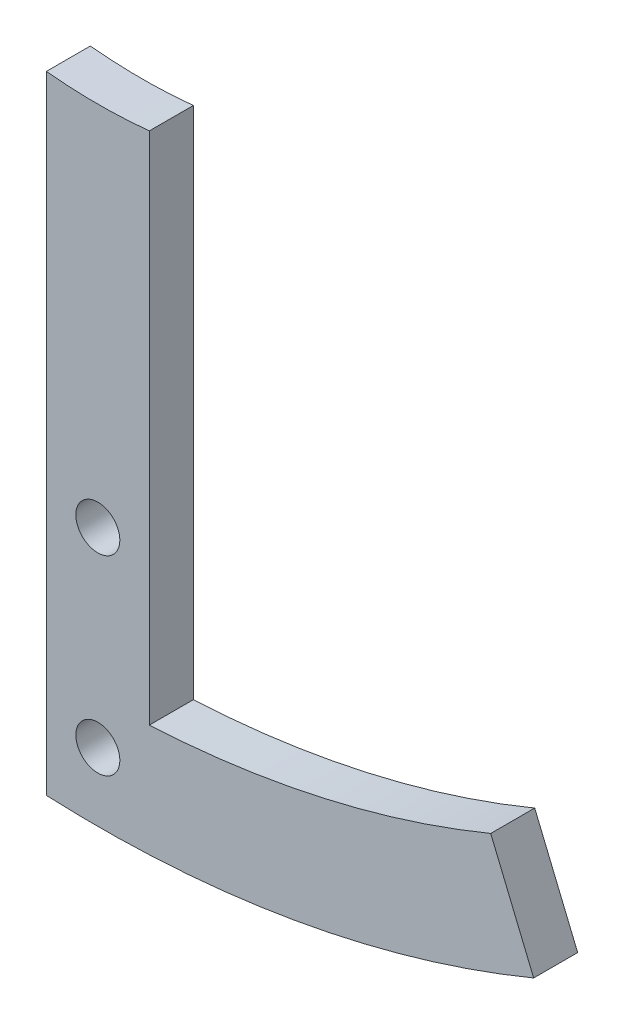
from build123d import *

# Parameters (mm, degrees)
SKETCH_1_R          = 18
LASHENA_DEPTH       = 3
CUT_EXTRUDEA_DEPTH  = 3
WWW_KYTOOL_CN_COUNT = 16
SKETCH_3_R          = 1.5
CUT_EXTRUDE_2_DEPTH = 10
SKETCH_4_R          = 1.5
CUT_EXTRUDE_3_DEPTH = 10
SKETCH_5_W          = 7.023251592
SKETCH_5_H          = 5.670576874
EXTRUDE_3_DEPTH     = 3
SKETCH_6_R          = 1.5
CUT_EXTRUDE_4_DEPTH = 3
SKETCH_8_R          = 35
CUT_EXTRUDE_5_DEPTH = 3


with BuildPart() as part:
    # 草图1 → LaShenA (new body)
    with BuildSketch(Plane.XY):
        Circle(SKETCH_1_R)
    extrude(amount=LASHENA_DEPTH)

    # SketchA → Cut-ExtrudeA (cut)
    with BuildSketch(Plane.XY.offset(3)):
        with BuildLine():
            ThreePointArc((0.423212707, 13.493364703), (0, 13.5), (-0.423212707, 13.493364703))
            ThreePointArc((-0.423212707, 13.493364703), (-0.952770902, 13.685686791), (-1.20440395, 14.18977059))
            add(Edge.make_bspline(
                [(-1.20440395, 14.18977059), (-1.226562505, 14.455224305), (-1.213843633, 14.773889884), (-1.273675597, 15.110607864), (-1.299119688, 15.21139578), (-1.321432077, 15.29109757), (-1.349914152, 15.382250837), (-1.385146673, 15.484587535), (-1.427834192, 15.597770763), (-1.478623281, 15.721446817), (-1.538159915, 15.855229004), (-1.607069773, 15.998703507), (-1.685962928, 16.151428337), (-1.775430978, 16.312934487), (-1.876046532, 16.482726463), (-1.98836201, 16.660283053), (-2.112908684, 16.845058076), (-2.250195688, 17.036481179), (-2.400709063, 17.233958676), (-2.56491084, 17.43687441), (-2.743238138, 17.644590662), (-2.936102365, 17.856449073), (-3.14388814, 18.07177164), (-3.447378451, 18.368492697), (-3.689495989, 18.585006365), (-3.858042439, 18.727457792)],
                knots=[0.122308221, 0.122308221, 0.122308221, 0.122308221, 0.250610689, 0.276296194, 0.287604067, 0.300967916, 0.316387742, 0.333863545, 0.353395324, 0.37498308, 0.398626813, 0.424326522, 0.452082207, 0.48189387, 0.513761509, 0.547685125, 0.583664717, 0.621700286, 0.661791832, 0.703939355, 0.748142854, 0.79440233, 0.842717782, 0.893089212, 1, 1, 1, 1], degree=3))
            ThreePointArc((-3.858042439, 18.727457792), (0, 19.120726106), (3.858042439, 18.727457792))
            add(Edge.make_bspline(
                [(1.20440395, 14.18977059), (1.226562505, 14.455224305), (1.213843633, 14.773889884), (1.273675597, 15.110607864), (1.299119688, 15.21139578), (1.321432077, 15.29109757), (1.349914152, 15.382250837), (1.385146673, 15.484587535), (1.427834192, 15.597770763), (1.478623281, 15.721446817), (1.538159915, 15.855229004), (1.607069773, 15.998703507), (1.685962928, 16.151428337), (1.775430978, 16.312934487), (1.876046532, 16.482726463), (1.98836201, 16.660283053), (2.112908684, 16.845058076), (2.250195688, 17.036481179), (2.400709063, 17.233958676), (2.56491084, 17.43687441), (2.743238138, 17.644590662), (2.936102365, 17.856449073), (3.14388814, 18.07177164), (3.447378451, 18.368492697), (3.689495989, 18.585006365), (3.858042439, 18.727457792)],
                knots=[0.122308221, 0.122308221, 0.122308221, 0.122308221, 0.250610689, 0.276296194, 0.287604067, 0.300967916, 0.316387742, 0.333863545, 0.353395324, 0.37498308, 0.398626813, 0.424326522, 0.452082207, 0.48189387, 0.513761509, 0.547685125, 0.583664717, 0.621700286, 0.661791832, 0.703939355, 0.748142854, 0.79440233, 0.842717782, 0.893089212, 1, 1, 1, 1], degree=3))
            ThreePointArc((1.20440395, 14.18977059), (0.952770902, 13.685686791), (0.423212707, 13.493364703))
        make_face()
    cut_extrudea = extrude(amount=-CUT_EXTRUDEA_DEPTH, mode=Mode.SUBTRACT)

    # www.KYTool.cn: Cut-ExtrudeA ×16 about axis
    www_kytool_cn_axis = Axis((0, 0, -80.9), (0, 0, 1))
    for i in range(1, WWW_KYTOOL_CN_COUNT):
        add(cut_extrudea.rotate(www_kytool_cn_axis, i * 360 / WWW_KYTOOL_CN_COUNT), mode=Mode.SUBTRACT)

    # 草图3 → 切除-拉伸2 (cut)
    with BuildSketch(Plane(origin=(0, 0, 0), x_dir=(-1, 0, 0), z_dir=(0, 0, -1))):
        Circle(SKETCH_3_R)
    extrude(amount=-CUT_EXTRUDE_2_DEPTH, mode=Mode.SUBTRACT)

    # 草图4 → 切除-拉伸3 (cut)
    with BuildSketch(Plane(origin=(0, 0, 0), x_dir=(-1, 0, 0), z_dir=(0, 0, -1))):
        with Locations((5, 0)):
            Circle(SKETCH_4_R)
        with Locations((0, -5)):
            Circle(SKETCH_4_R)
        with Locations((-5, 0)):
            Circle(SKETCH_4_R)
        with Locations((0, 5)):
            Circle(SKETCH_4_R)
    extrude(amount=-CUT_EXTRUDE_3_DEPTH, mode=Mode.SUBTRACT)

    # 草图5 → 凸台-拉伸3 (add)
    with BuildSketch(Plane(origin=(0, 0, 0), x_dir=(-1, 0, 0), z_dir=(0, 0, -1))):
        with Locations((0, -14.81884661)):
            Rectangle(SKETCH_5_W, SKETCH_5_H)
        with BuildLine():
            ThreePointArc((3.511625796, -17.654135047), (0, -18), (-3.511625796, -17.654135047))
            Line((-3.511625796, -17.654135047), (-3.511625796, -69.911862257))
            ThreePointArc((-3.511625796, -69.911862257), (0, -70), (3.511625796, -69.911862257))
            Line((3.511625796, -69.911862257), (3.511625796, -17.654135047))
        make_face()
        with BuildLine():
            ThreePointArc((3.511625796, -69.911862257), (0, -70), (-3.511625796, -69.911862257))
            Line((-3.511625796, -69.911862257), (-3.511625796, -77.574694161))
            ThreePointArc((-3.511625796, -77.574694161), (0, -77.654135047), (3.511625796, -77.574694161))
            Line((3.511625796, -77.574694161), (3.511625796, -69.911862257))
        make_face()
        with BuildLine():
            Line((-3.511625796, -77.574694161), (-3.511625796, -69.911862257))
            ThreePointArc((-3.511625796, -69.911862257), (-15.374640932, -68.290705196), (-26.787840266, -64.671567276))
            Line((-26.787840266, -64.671567276), (-29.716950937, -71.743065985))
            ThreePointArc((-29.716950937, -71.743065985), (-16.868211219, -75.799921769), (-3.511625796, -77.574694161))
        make_face()
        with BuildLine():
            Line((3.511625796, -17.654135047), (-3.511625796, -17.654135047))
            ThreePointArc((-3.511625796, -17.654135047), (0, -18), (3.511625796, -17.654135047))
        make_face()
    extrude(amount=-EXTRUDE_3_DEPTH)

    # 草图6 → 切除-拉伸4 (cut)
    with BuildSketch(Plane.XY.offset(3)):
        with Locations((0, -60)):
            Circle(SKETCH_6_R)
        with Locations((0, -73)):
            Circle(SKETCH_6_R)
    extrude(amount=-CUT_EXTRUDE_4_DEPTH, mode=Mode.SUBTRACT)

    # 草图8 → 切除-拉伸5 (cut)
    with BuildSketch(Plane.XY.offset(3)):
        Circle(SKETCH_8_R)
    extrude(amount=-CUT_EXTRUDE_5_DEPTH, mode=Mode.SUBTRACT)


solid = part.part
